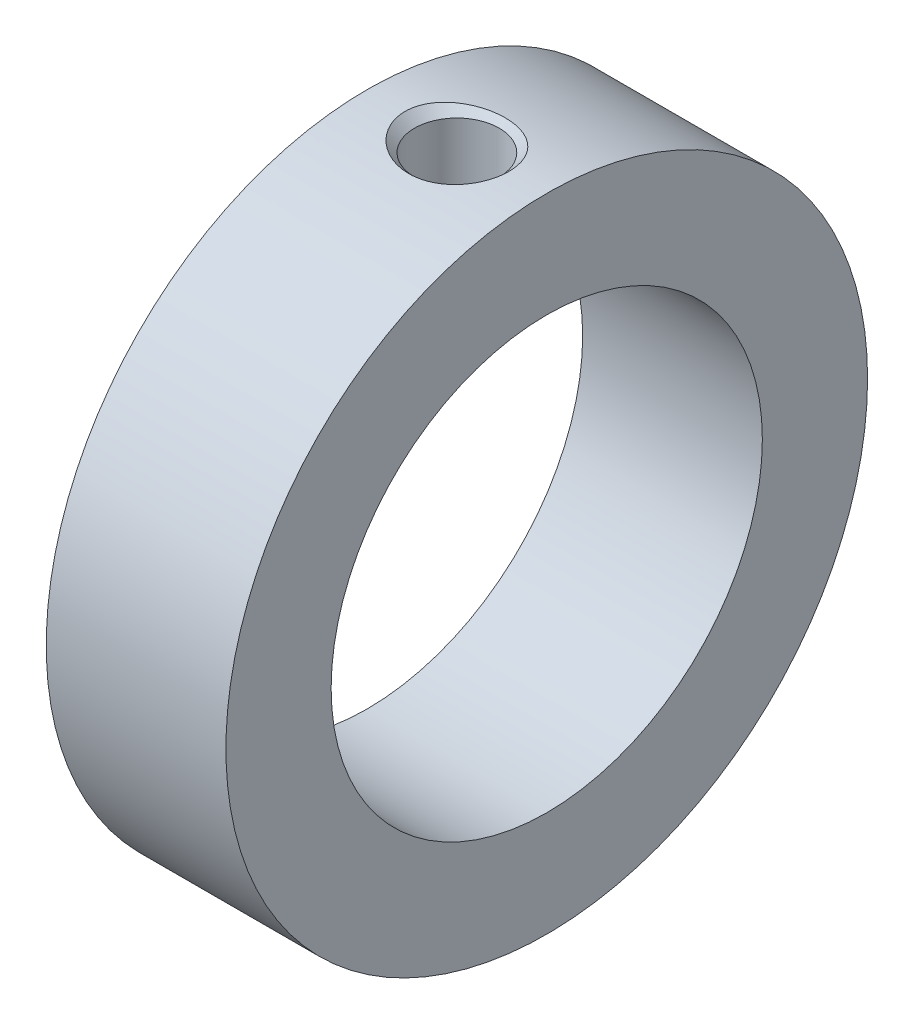
from build123d import *

# Parameters (mm, degrees)
SKETCH1_R                   = 12.5
SKETCH1_R_2                 = 8.4
BOSS_EXTRUDE1_DEPTH         = 7
M4_TAPPED_HOLE1_D           = 3.3
M4_TAPPED_HOLE1_DEPTH       = 11.5
M4_TAPPED_HOLE1_CSINK_D     = 4.05
M4_TAPPED_HOLE1_CSINK_ANGLE = 90
M4_TAPPED_HOLE1_TIP         = 0.991420021


with BuildPart() as part:
    # Sketch1 → Boss-Extrude1 (new body)
    with BuildSketch(Plane(origin=(0, 0, 0), x_dir=(0, 0, -1), z_dir=(1, 0, 0))):
        Circle(SKETCH1_R)
        Circle(SKETCH1_R_2, mode=Mode.SUBTRACT)
    extrude(amount=BOSS_EXTRUDE1_DEPTH)

    # M4 Tapped Hole1
    with Locations(Plane(origin=(3.5, 12.5, 0), x_dir=(0, 0, 1), z_dir=(0, 1, 0))):
        with Locations((0, 0)):
            CounterSinkHole(M4_TAPPED_HOLE1_D / 2, M4_TAPPED_HOLE1_CSINK_D / 2, depth=M4_TAPPED_HOLE1_DEPTH, counter_sink_angle=M4_TAPPED_HOLE1_CSINK_ANGLE)
            with Locations((0, 0, -(M4_TAPPED_HOLE1_DEPTH + M4_TAPPED_HOLE1_TIP / 2))):  # 118° drill point
                Cone(0, M4_TAPPED_HOLE1_D / 2, M4_TAPPED_HOLE1_TIP, mode=Mode.SUBTRACT)


solid = part.part
